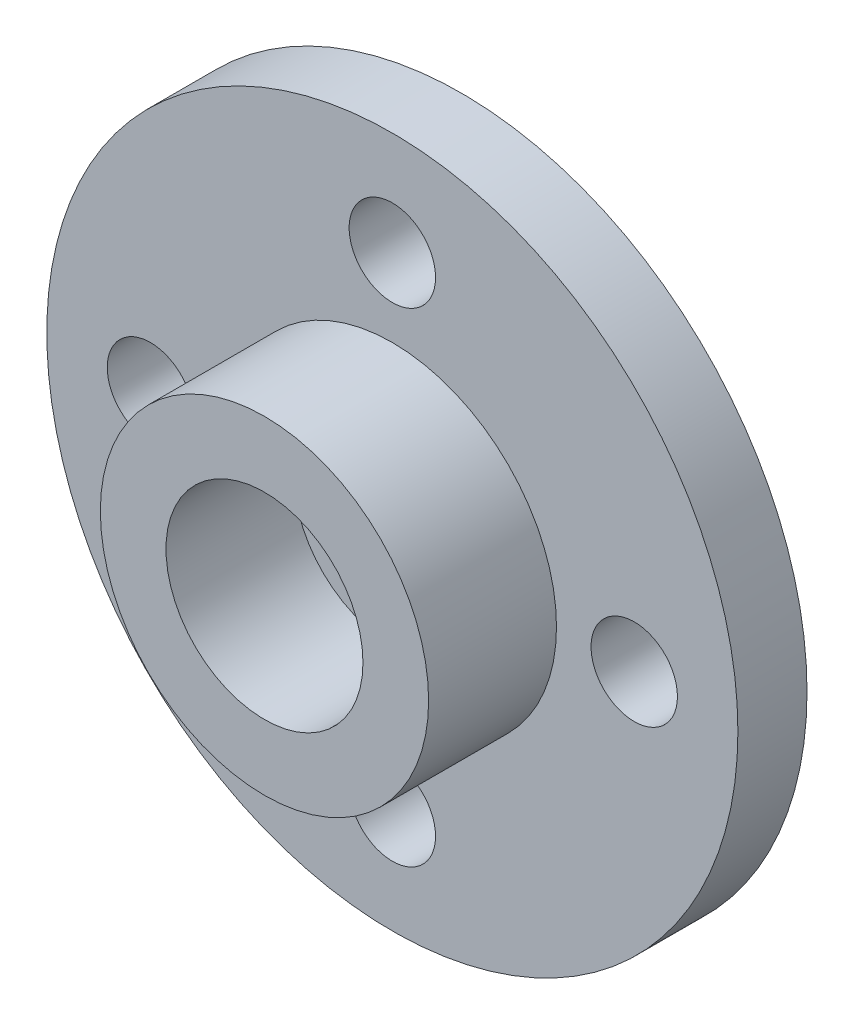
from build123d import *

# Parameters (mm, degrees)
ESQUISSE1_R        = 10
ESQUISSE1_R_2      = 1.65
ESQUISSE1_R_3      = 1.25
BOSS_EXTRU_1_DEPTH = 2
ESQUISSE2_R        = 4.75
ESQUISSE2_R_2      = 2.85
BOSS_EXTRU_2_DEPTH = 3.7


with BuildPart() as part:
    # Esquisse1 → Boss.-Extru.1 (new body)
    with BuildSketch(Plane.XY):
        Circle(ESQUISSE1_R)
        Circle(ESQUISSE1_R_2, mode=Mode.SUBTRACT)
        with Locations((0, 7)):
            Circle(ESQUISSE1_R_3, mode=Mode.SUBTRACT)
        with Locations((7, 0)):
            Circle(ESQUISSE1_R_3, mode=Mode.SUBTRACT)
        with Locations((0, -7)):
            Circle(ESQUISSE1_R_3, mode=Mode.SUBTRACT)
        with Locations((-7, 0)):
            Circle(ESQUISSE1_R_3, mode=Mode.SUBTRACT)
    extrude(amount=BOSS_EXTRU_1_DEPTH)

    # Esquisse2 → Boss.-Extru.2 (add)
    with BuildSketch(Plane.XY.offset(2)):
        Circle(ESQUISSE2_R)
        Circle(ESQUISSE2_R_2, mode=Mode.SUBTRACT)
    extrude(amount=BOSS_EXTRU_2_DEPTH)


solid = part.part
